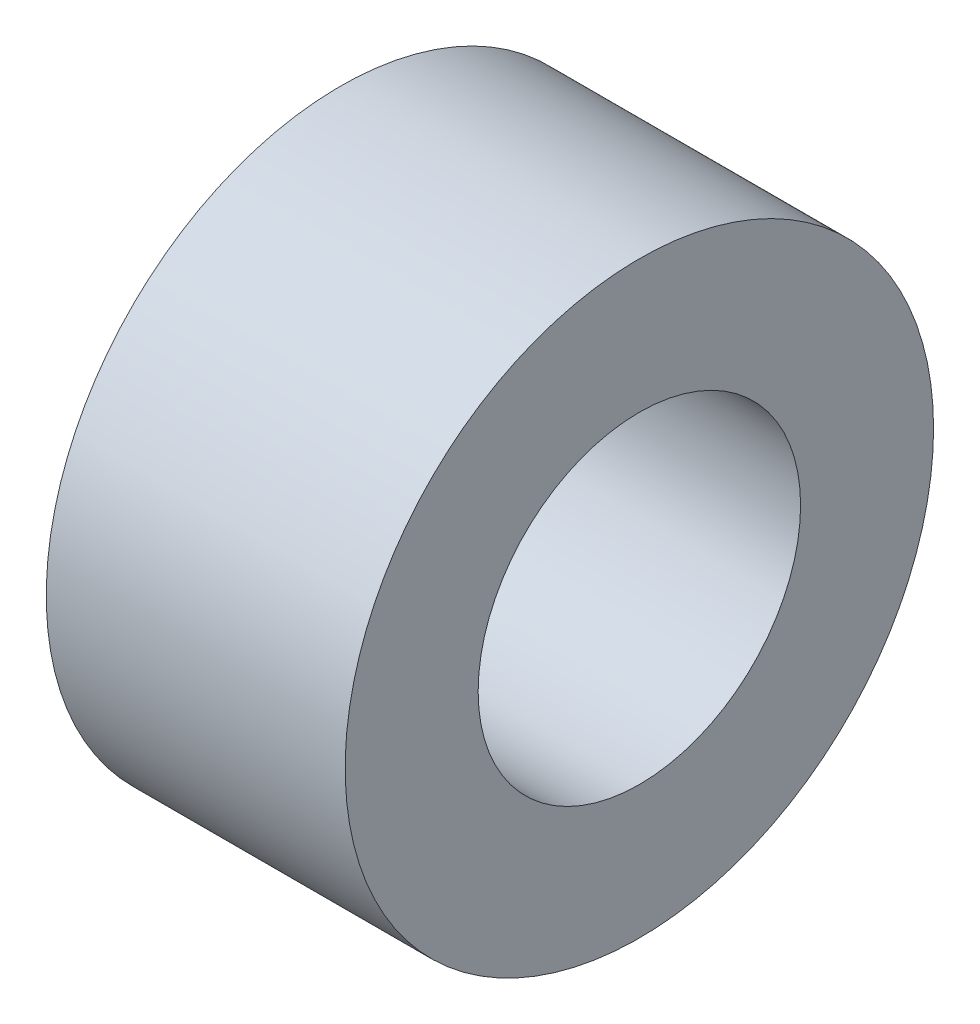
from build123d import *

# Parameters (mm, degrees)
SKETCH1_R           = 6.25
SKETCH1_R_2         = 3.425
BOSS_EXTRUDE1_DEPTH = 6.35


with BuildPart() as part:
    # Sketch1 → Boss-Extrude1 (new body)
    with BuildSketch(Plane(origin=(0, 0, 0), x_dir=(0, 0, -1), z_dir=(1, 0, 0))):
        Circle(SKETCH1_R)
        Circle(SKETCH1_R_2, mode=Mode.SUBTRACT)
    extrude(amount=BOSS_EXTRUDE1_DEPTH)


solid = part.part
